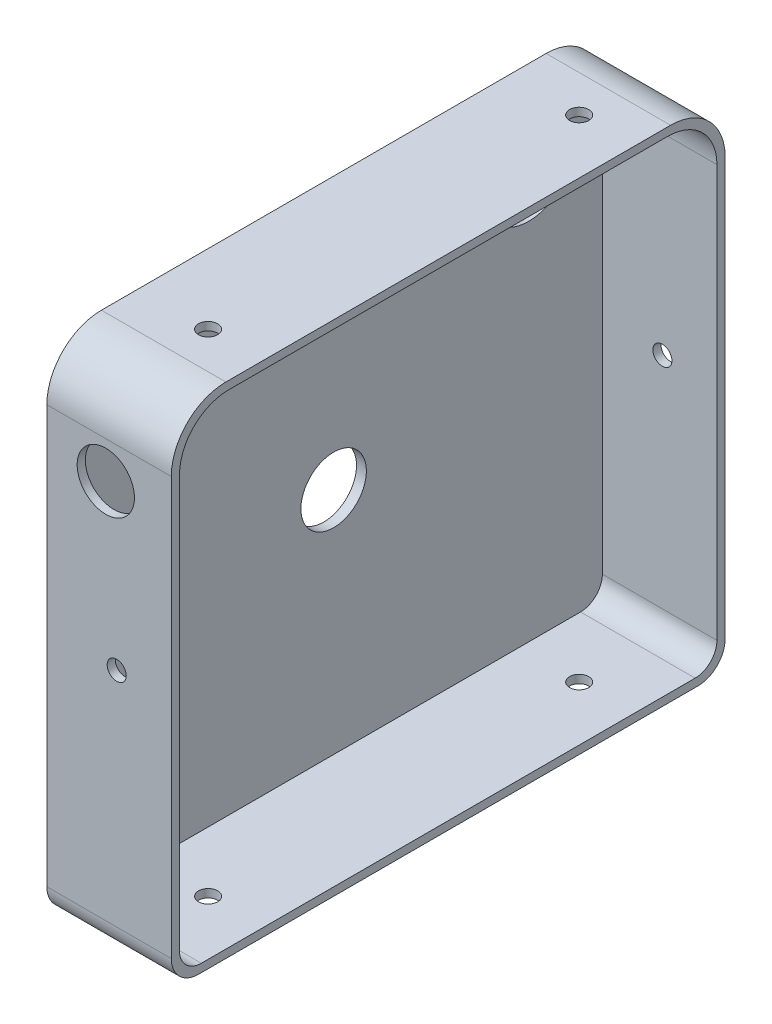
from build123d import *

# Parameters (mm, degrees)
SKETCH_1_W          = 101.5
SKETCH_1_H          = 91.5
SKETCH_1_W_2        = 98.5
SKETCH_1_H_2        = 88.5
EXTRUDE_1_DEPTH     = 21
SKETCH_2_W          = 101.5
SKETCH_2_H          = 91.5
SKETCH_2_R          = 8.25
SKETCH_2_R_2        = 6
EXTRUDE_2_DEPTH     = 1.8
SKETCH_3_R          = 1.75
CUT_EXTRUDE_1_DEPTH = 139.25881527
SKETCH_4_R          = 1.75
CUT_EXTRUDE_2_DEPTH = 139.25881527
FILLET_1_R          = 9
FILLET_2_R          = 10
FILLET_3_R          = 4
FILLET_4_R          = 5
CUT_EXTRUDE_3_DEPTH = 1
CUT_EXTRUDE_4_REACH = 140.259
SKETCH_6_R          = 5.25


with BuildPart() as part:
    # 草图1 → 凸台-拉伸1 (new body)
    with BuildSketch(Plane(origin=(0, 0, 0), x_dir=(0, 0, -1), z_dir=(1, 0, 0))):
        with Locations((50.75, 45.75)):
            Rectangle(SKETCH_1_W, SKETCH_1_H)
        with Locations((50.75, 45.75)):
            Rectangle(SKETCH_1_W_2, SKETCH_1_H_2, mode=Mode.SUBTRACT)
    extrude(amount=EXTRUDE_1_DEPTH)

    # 草图2 → 凸台-拉伸2 (add)
    with BuildSketch(Plane.ZY):
        with Locations((-50.75, 45.75)):
            Rectangle(SKETCH_2_W, SKETCH_2_H)
        with Locations((-86.5, 76.5)):
            Circle(SKETCH_2_R, mode=Mode.SUBTRACT)
        with Locations((-50.75, 43.5)):
            Circle(SKETCH_2_R_2, mode=Mode.SUBTRACT)
    extrude(amount=EXTRUDE_2_DEPTH)

    # 草图3 → 切除-拉伸1 (cut, through all)
    with BuildSketch(Plane.XY):
        with Locations((11, 45.75)):
            Circle(SKETCH_3_R)
    extrude(amount=-CUT_EXTRUDE_1_DEPTH, mode=Mode.SUBTRACT)

    # 草图4 → 切除-拉伸2 (cut, through all)
    with BuildSketch(Plane(origin=(0, 91.5, 0), x_dir=(1, 0, 0), z_dir=(0, 1, 0))):
        with Locations(Location((11, 16.75, 0), (0, 0, 270))):
            Circle(SKETCH_4_R)
        with Locations(Location((11, 84.75, 0), (0, 0, 90))):
            Circle(SKETCH_4_R)
    extrude(amount=-CUT_EXTRUDE_2_DEPTH, mode=Mode.SUBTRACT)

    # 圆角1
    fillet_1_edges = [part.edges().sort_by_distance(p)[0] for p in [
        (10.5, 90, -100),
        (10.5, 90, -1.5),
    ]]
    fillet(fillet_1_edges, radius=FILLET_1_R)

    # 圆角2
    fillet_2_edges = [part.edges().sort_by_distance(p)[0] for p in [
        (9.6, 91.5, 0),
        (9.6, 91.5, -101.5),
    ]]
    fillet(fillet_2_edges, radius=FILLET_2_R)

    # 圆角3
    fillet_3_edges = [part.edges().sort_by_distance(p)[0] for p in [
        (10.5, 1.5, -1.5),
        (10.5, 1.5, -100),
    ]]
    fillet(fillet_3_edges, radius=FILLET_3_R)

    # 圆角4
    fillet_4_edges = [part.edges().sort_by_distance(p)[0] for p in [
        (9.6, 0, -101.5),
        (9.6, 0, 0),
    ]]
    fillet(fillet_4_edges, radius=FILLET_4_R)

    # 草图5 → 切除-拉伸3 (cut)
    with BuildSketch(Plane.ZY.offset(1.8)):
        with BuildLine():
            Line((-30.75, 43.5), (-20.75, 43.5))
            ThreePointArc((-20.75, 43.5), (-45.75, 68.5), (-70.75, 43.5))
            ThreePointArc((-70.75, 43.5), (-50.75, 63.5), (-30.75, 43.5))
        make_face()
    extrude(amount=-CUT_EXTRUDE_3_DEPTH, mode=Mode.SUBTRACT)

    # 草图6 → 切除-拉伸4 (cut, up to next)
    with BuildSketch(Plane.XY, mode=Mode.PRIVATE) as cut_extrude_4_sk1:
        with Locations((9, 74.75)):
            Circle(SKETCH_6_R)
    cut_extrude_4_tool1 = extrude(cut_extrude_4_sk1.sketch, amount=-CUT_EXTRUDE_4_REACH, mode=Mode.PRIVATE) & part.part
    add(cut_extrude_4_tool1.solids().sort_by_distance((9, 74.75, 0))[0], mode=Mode.SUBTRACT)


solid = part.part
